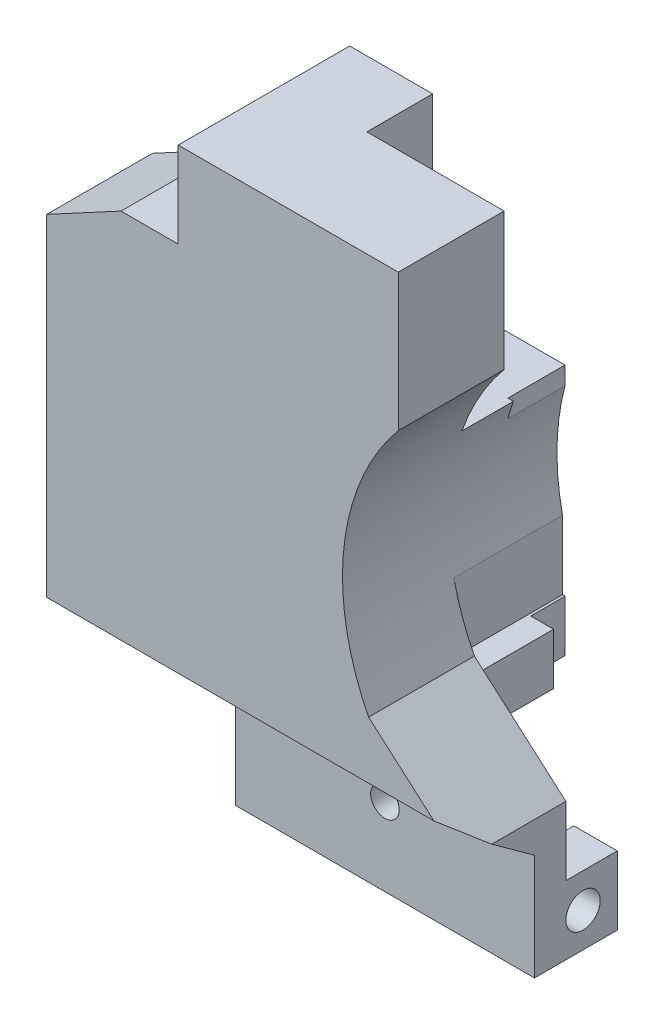
from build123d import *

# Parameters (mm, degrees)
BOSS_EXTRUDE1_DEPTH      = 18.75
SKETCH4_W                = 36.15
SKETCH4_H                = 12.5
CUT_EXTRUDE1_DEPTH       = 5
CUT_EXTRUDE2_DEPTH       = 6
CUT_EXTRUDE2_DEPTH_BACK  = 4.5
SKETCH6_R                = 1.5
CUT_EXTRUDE3_DEPTH       = 60.223179584
SKETCH7_W                = 2
SKETCH7_H                = 4.5
SKETCH7_W_2              = 1.25
CUT_EXTRUDE4_DEPTH       = 3
SKETCH7_3_W              = 1.25
SKETCH7_3_H              = 2.5
CUT_EXTRUDE5_DEPTH       = 5
CUT_EXTRUDE6_DEPTH       = 9.5
SKETCH9_W                = 7.25
SKETCH9_H                = 6.25
BOSS_EXTRUDE2_DEPTH      = 5.75
CUT_EXTRUDE7_DEPTH       = 9.5
CUT_EXTRUDE8_DEPTH       = 12
CUT_EXTRUDE8_DEPTH_BACK  = 54.706470746
CUT_EXTRUDE11_DEPTH      = 6
CUT_EXTRUDE11_DEPTH_BACK = 2.75
SKETCH12_W               = 15.15
SKETCH12_H               = 4.7
SKETCH13_R               = 1.25
CUT_EXTRUDE12_DEPTH      = 58.496825999


with BuildPart() as part:
    # Sketch1 → Boss-Extrude1 (new body)
    with BuildSketch(Plane.XY):
        with BuildLine():
            Line((11.5, 3.5), (11.5, 11))
            Line((11.5, 11), (30.75, 11))
            Line((30.75, 11), (30.75, -1))
            ThreePointArc((30.75, -1), (26.002013283, -12.110227589), (28.15, -24))
            Line((28.15, -24), (36.15, -31))
            Line((36.15, -31), (36.15, -43))
            Line((36.15, -43), (10, -43))
            Line((10, -43), (10, -34.5))
            Line((10, -34.5), (5, -30.5))
            Line((5, -30.5), (0, -30.5))
            Line((0, -30.5), (0, 0))
            Line((0, 0), (6.5, 3.5))
            Line((6.5, 3.5), (11.5, 3.5))
        make_face()
    extrude(amount=BOSS_EXTRUDE1_DEPTH)

    # Sketch4 → Cut-Extrude1 (cut)
    with BuildSketch(Plane(origin=(0, 0, 0), x_dir=(-1, 0, 0), z_dir=(0, 0, -1))):
        with Locations((-18.075, -36.75)):
            Rectangle(SKETCH4_W, SKETCH4_H)
    extrude(amount=-CUT_EXTRUDE1_DEPTH, mode=Mode.SUBTRACT)

    # Sketch5 → Cut-Extrude2 (cut, two sides: drawn at the far end of the back side and taken through both)
    with BuildSketch(Plane(origin=(0, 0, 5), x_dir=(-1, 0, 0), z_dir=(0, 0, -1)).offset(-CUT_EXTRUDE2_DEPTH_BACK)):
        Polygon((-32.35, -43), (-13.8, -43), (-13.8, -37), (0.902131261, -37), (0.902131261, -29.5), (-36.15, -29.5), (-36.15, -37), (-32.35, -37), align=None)
    extrude(amount=CUT_EXTRUDE2_DEPTH + CUT_EXTRUDE2_DEPTH_BACK, mode=Mode.SUBTRACT)

    # Sketch6 → Cut-Extrude3 (cut, through all)
    with BuildSketch(Plane(origin=(36.15, 0, 0), x_dir=(0, 0, -1), z_dir=(1, 0, 0))):
        with Locations(Location((-8, -40, 0), (0, 0, 90))):
            Circle(SKETCH6_R)
    extrude(amount=-CUT_EXTRUDE3_DEPTH, mode=Mode.SUBTRACT)

    # Sketch7 → Cut-Extrude4 (cut)
    with BuildSketch(Plane(origin=(0, 0, 0), x_dir=(-1, 0, 0), z_dir=(0, 0, -1))):
        with Locations((-27.575, -27.25)):
            Rectangle(SKETCH7_W, SKETCH7_H)
        with Locations((-8.95, -27.25)):
            Rectangle(SKETCH7_W_2, SKETCH7_H)
    extrude(amount=-CUT_EXTRUDE4_DEPTH, mode=Mode.SUBTRACT)

    # Sketch7<3> → Cut-Extrude5 (cut)
    with BuildSketch(Plane(origin=(0, 0, 0), x_dir=(-1, 0, 0), z_dir=(0, 0, -1))):
        with Locations((-8.95, -8.75)):
            Rectangle(SKETCH7_3_W, SKETCH7_3_H)
        with BuildLine():
            ThreePointArc((-27.058287436, -7.5), (-26.801337311, -8.279605972), (-26.575, -9.068643524))
            Line((-26.575, -9.068643524), (-26.575, -7.5))
            Line((-26.575, -7.5), (-27.058287436, -7.5))
        make_face()
    extrude(amount=-CUT_EXTRUDE5_DEPTH, mode=Mode.SUBTRACT)

    # Sketch8 → Cut-Extrude6 (cut)
    with BuildSketch(Plane(origin=(0, 0, 0), x_dir=(-1, 0, 0), z_dir=(0, 0, -1))):
        Polygon((-8.325, -10), (-8.325, -7.5), (-33.629917385, -7.5), (-33.629917385, 11), (0, 11), (0, -30.5), (-8.325, -30.5), (-8.325, -25), (-9.575, -25), (-9.575, -10), align=None)
    extrude(amount=-CUT_EXTRUDE6_DEPTH, mode=Mode.SUBTRACT)

    # Sketch9 → Boss-Extrude2 (add)
    with BuildSketch(Plane(origin=(0, 0, 9.5), x_dir=(-1, 0, 0), z_dir=(0, 0, -1))):
        with Locations((-15.125, 7.875)):
            Rectangle(SKETCH9_W, SKETCH9_H)
    extrude(amount=BOSS_EXTRUDE2_DEPTH)

    # Sketch10 → Cut-Extrude7 (cut)
    with BuildSketch(Plane(origin=(0, 0, 0), x_dir=(-1, 0, 0), z_dir=(0, 0, -1))):
        Polygon((-35.578571429, -29.5), (-28.575, -29.5), (-28.575, -25), (-26.356090024, -25), (-26.356090024, -9.972017094), (-27.488550882, -9.972017094), (-27.488550882, -22.567234298), (-35.578571429, -22.567234298), align=None)
    extrude(amount=-CUT_EXTRUDE7_DEPTH, mode=Mode.SUBTRACT)

    # Sketch11 → Cut-Extrude8 (cut, two sides: drawn at the far end of the back side and taken through both)
    with BuildSketch(Plane.ZY.offset(-10).offset(-CUT_EXTRUDE8_DEPTH_BACK)):
        Polygon((12.25, -43), (18.75, -43), (18.75, -29), (12.25, -33.7), align=None)
    extrude(amount=CUT_EXTRUDE8_DEPTH + CUT_EXTRUDE8_DEPTH_BACK, mode=Mode.SUBTRACT)

    # Sketch12 → Cut-Extrude11 (cut, two sides: drawn at the far end of the back side and taken through both)
    with BuildSketch(Plane.XY.offset(12.25).offset(-CUT_EXTRUDE11_DEPTH_BACK)):
        with Locations((19.575, -31.35)):
            Rectangle(SKETCH12_W, SKETCH12_H)
    extrude(amount=CUT_EXTRUDE11_DEPTH + CUT_EXTRUDE11_DEPTH_BACK, mode=Mode.SUBTRACT)

    # Sketch13 → Cut-Extrude12 (cut, through all)
    with BuildSketch(Plane.XY.offset(12.25)):
        with Locations((23.075, -36.2)):
            Circle(SKETCH13_R)
    extrude(amount=-CUT_EXTRUDE12_DEPTH, mode=Mode.SUBTRACT)


solid = part.part
